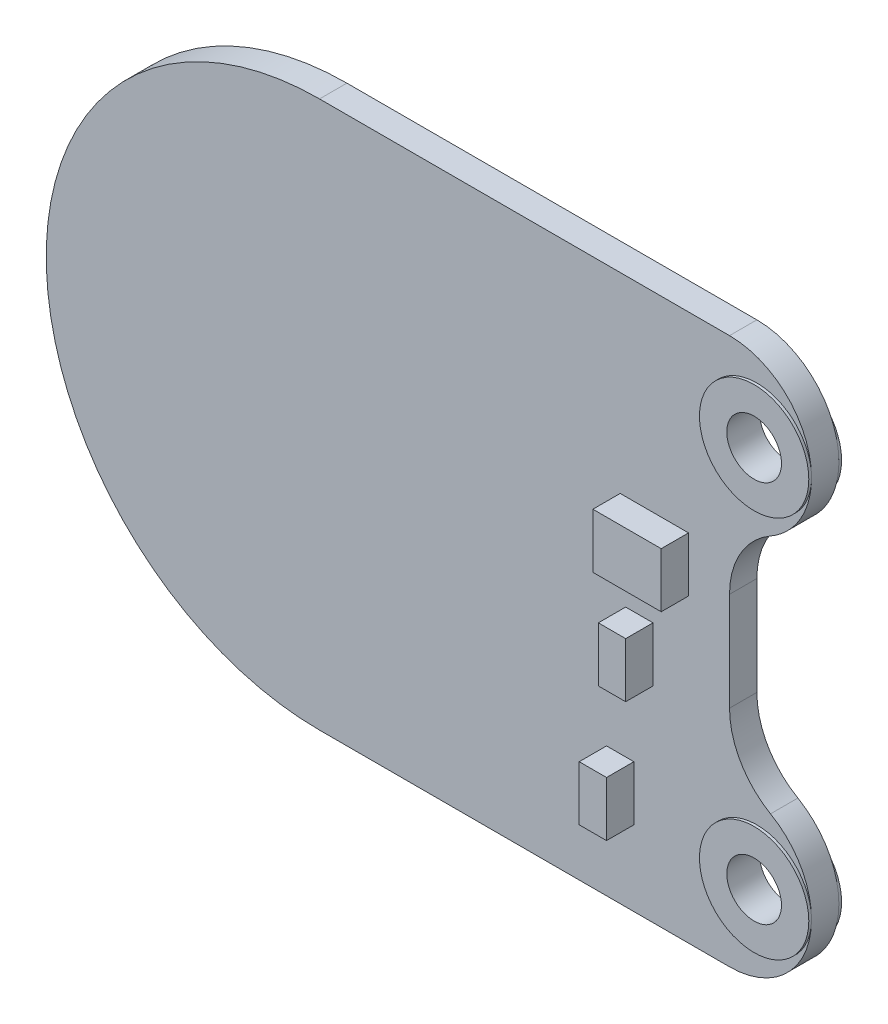
from build123d import *

# Parameters (mm, degrees)
SKETCH1_R                = 1
BOSS_EXTRUDE1_DEPTH      = 1
FILLET1_R                = 3
BOSS_EXTRUDE2_DEPTH      = 0.1
BOSS_EXTRUDE2_DEPTH_BACK = 1.1
SKETCH2_R                = 2
SKETCH3_R                = 1
CUT_EXTRUDE1_DEPTH       = 2
SKETCH4_W                = 2.5
SKETCH4_H                = 2
SKETCH4_W_2              = 1
BOSS_EXTRUDE3_DEPTH      = 1


with BuildPart() as part:
    # Sketch1 → Boss-Extrude1 (new body)
    with BuildSketch(Plane.XY):
        with BuildLine():
            Line((11, 4), (11, -4))
            ThreePointArc((11, -4), (14, -7), (11, -10))
            Line((11, -10), (-4, -10))
            ThreePointArc((-4, -10), (-14, 0), (-4, 10))
            Line((-4, 10), (11, 10))
            ThreePointArc((11, 10), (14, 7), (11, 4))
        make_face()
        with Locations((12, 7)):
            Circle(SKETCH1_R, mode=Mode.SUBTRACT)
        with Locations((12, -7)):
            Circle(SKETCH1_R, mode=Mode.SUBTRACT)
    extrude(amount=BOSS_EXTRUDE1_DEPTH)

    # Fillet1
    fillet1_edges = [part.edges().sort_by_distance(p)[0] for p in [
        (11, 4, 0.5),
        (11, -4, 0.5),
    ]]
    fillet(fillet1_edges, radius=FILLET1_R)

    # Sketch2 → Boss-Extrude2 (add, two sides: drawn at the far end of the back side and taken through both)
    with BuildSketch(Plane.XY.offset(1).offset(-BOSS_EXTRUDE2_DEPTH_BACK)):
        with Locations((12, 7)):
            Circle(SKETCH2_R)
        with Locations((12, -7)):
            Circle(SKETCH2_R)
    extrude(amount=BOSS_EXTRUDE2_DEPTH + BOSS_EXTRUDE2_DEPTH_BACK)

    # Sketch3 → Cut-Extrude1 (cut)
    with BuildSketch(Plane.XY.offset(1.1)):
        with Locations((12, 7)):
            Circle(SKETCH3_R)
        with Locations((12, -7)):
            Circle(SKETCH3_R)
    extrude(amount=-CUT_EXTRUDE1_DEPTH, mode=Mode.SUBTRACT)

    # Sketch4 → Boss-Extrude3 (add)
    with BuildSketch(Plane.XY.offset(1)):
        with Locations((8.25, 2)):
            Rectangle(SKETCH4_W, SKETCH4_H)
        with Locations((7.7, -1.5)):
            Rectangle(SKETCH4_W_2, SKETCH4_H)
        with Locations((7, -6.25)):
            Rectangle(SKETCH4_W_2, SKETCH4_H)
    extrude(amount=BOSS_EXTRUDE3_DEPTH)


solid = part.part
